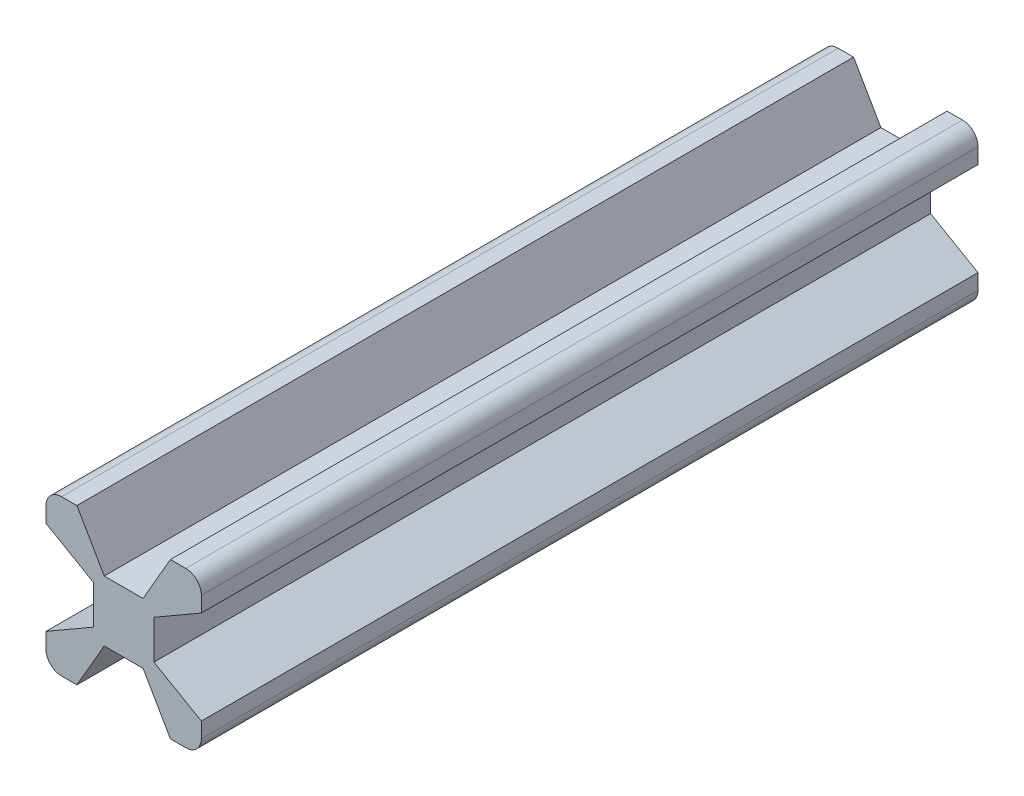
from build123d import *

# Parameters (mm, degrees)
SKETCH1_W           = 20
SKETCH1_H           = 20
BOSS_EXTRUDE1_DEPTH = 100
CUT_EXTRUDE1_DEPTH  = 101.995049384
CIRPATTERN1_COUNT   = 4
FILLET1_R           = 2


with BuildPart() as part:
    # Sketch1 → Boss-Extrude1 (new body)
    with BuildSketch(Plane.XY):
        Rectangle(SKETCH1_W, SKETCH1_H)
    extrude(amount=BOSS_EXTRUDE1_DEPTH)

    # Sketch2 → Cut-Extrude1 (cut, through all)
    with BuildSketch(Plane.XY):
        Polygon((6.021836642, 10), (-6.021836642, 10), (-2.5, 3.9), (2.5, 3.9), align=None)
    cut_extrude1 = extrude(amount=CUT_EXTRUDE1_DEPTH, mode=Mode.SUBTRACT)

    # CirPattern1: Cut-Extrude1 ×4 about axis
    cirpattern1_axis = Axis((0, 0, -5), (0, 0, 1))
    for i in range(1, CIRPATTERN1_COUNT):
        add(cut_extrude1.rotate(cirpattern1_axis, i * 360 / CIRPATTERN1_COUNT), mode=Mode.SUBTRACT)

    # Fillet1
    fillet1_edges = [part.edges().sort_by_distance(p)[0] for p in [
        (-10, -10, 50),
        (10, -10, 50),
        (10, 10, 50),
        (-10, 10, 50),
    ]]
    fillet(fillet1_edges, radius=FILLET1_R)


solid = part.part
